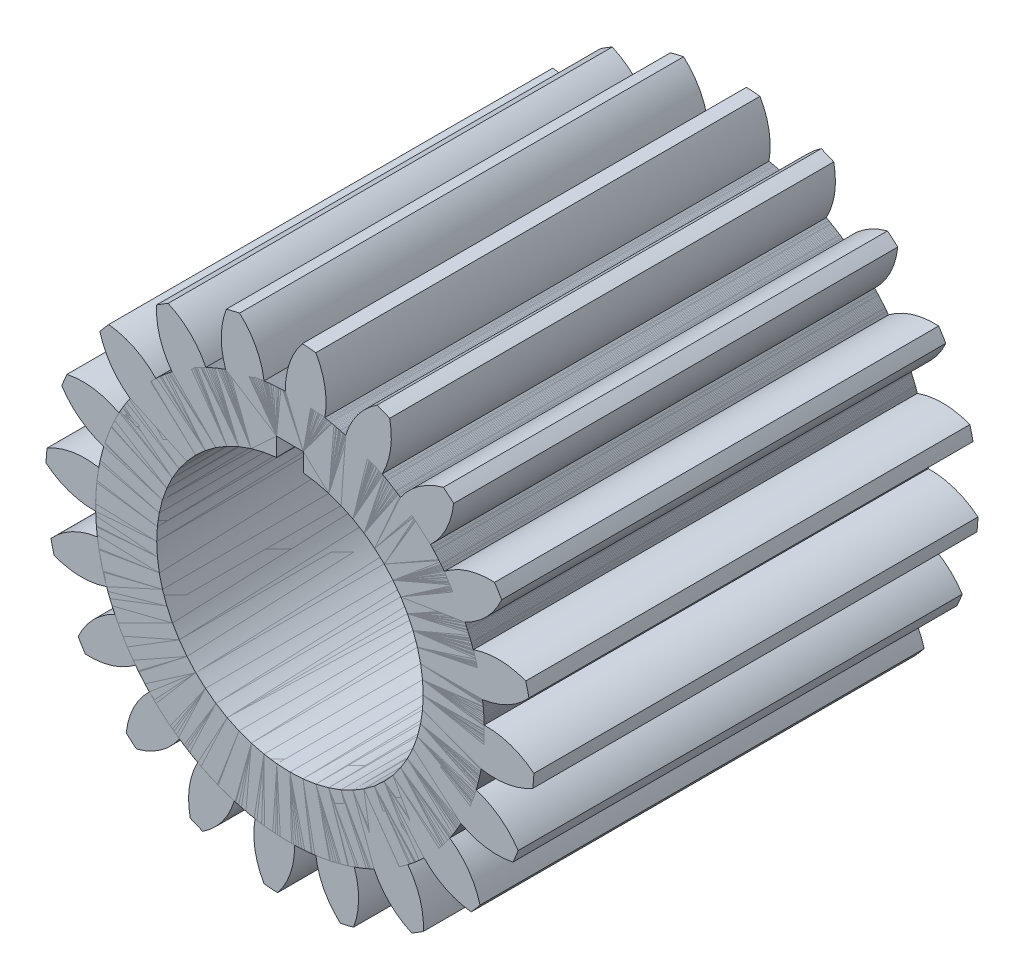
from build123d import *

# Parameters (mm, degrees)
SKETCH_1_R               = 21.875
EXTRUDE_1_DEPTH          = 50
EXTRUDE_START            = -50
EXTRUDE_2_DEPTH          = 50
PATTERN_CIRCULAR_1_COUNT = 20
SKETCH_3_R               = 15
CUT_EXTRUDE_1_DEPTH      = 64.313510489
SKETCH_6_W               = 3
SKETCH_6_H               = 17
CUT_EXTRUDE_4_DEPTH      = 64.313510489


with BuildPart() as part:
    # 草图1 → 凸台-拉伸1 (new body)
    with BuildSketch(Plane.XY):
        Circle(SKETCH_1_R)
    extrude(amount=EXTRUDE_1_DEPTH)

    # 草图2 → 凸台-拉伸2 (add)
    with BuildSketch(Plane.XY.offset(50).offset(EXTRUDE_START)):
        with BuildLine():
            ThreePointArc((2.917275003, 27.344825956), (2.157625133, 27.415226678), (1.396314713, 27.464528127))
            ThreePointArc((1.396314713, 27.464528127), (-0.057452176, 24.837047161), (-0.513162723, 21.868980064))
            ThreePointArc((-0.513162723, 21.868980064), (1.716292719, 21.807566675), (3.927907035, 21.519460293))
            ThreePointArc((3.927907035, 21.519460293), (3.94211503, 24.522274395), (2.917275003, 27.344825956))
        make_face()
    extrude(amount=EXTRUDE_2_DEPTH)


with BuildPart() as pattern_circular_1_1:
    # 阵列(圆周)1: pattern copy
    add(part.part.rotate(Axis((0, 0, 50), (0, 0, 1)), 1 * 360 / PATTERN_CIRCULAR_1_COUNT))


with BuildPart() as pattern_circular_1_2:
    # 阵列(圆周)1: pattern copy
    add(part.part.rotate(Axis((0, 0, 50), (0, 0, 1)), 2 * 360 / PATTERN_CIRCULAR_1_COUNT))


with BuildPart() as pattern_circular_1_3:
    # 阵列(圆周)1: pattern copy
    add(part.part.rotate(Axis((0, 0, 50), (0, 0, 1)), 3 * 360 / PATTERN_CIRCULAR_1_COUNT))


with BuildPart() as pattern_circular_1_4:
    # 阵列(圆周)1: pattern copy
    add(part.part.rotate(Axis((0, 0, 50), (0, 0, 1)), 4 * 360 / PATTERN_CIRCULAR_1_COUNT))


with BuildPart() as pattern_circular_1_5:
    # 阵列(圆周)1: pattern copy
    add(part.part.rotate(Axis((0, 0, 50), (0, 0, 1)), 5 * 360 / PATTERN_CIRCULAR_1_COUNT))


with BuildPart() as pattern_circular_1_6:
    # 阵列(圆周)1: pattern copy
    add(part.part.rotate(Axis((0, 0, 50), (0, 0, 1)), 6 * 360 / PATTERN_CIRCULAR_1_COUNT))


with BuildPart() as pattern_circular_1_7:
    # 阵列(圆周)1: pattern copy
    add(part.part.rotate(Axis((0, 0, 50), (0, 0, 1)), 7 * 360 / PATTERN_CIRCULAR_1_COUNT))


with BuildPart() as pattern_circular_1_8:
    # 阵列(圆周)1: pattern copy
    add(part.part.rotate(Axis((0, 0, 50), (0, 0, 1)), 8 * 360 / PATTERN_CIRCULAR_1_COUNT))


with BuildPart() as pattern_circular_1_9:
    # 阵列(圆周)1: pattern copy
    add(part.part.rotate(Axis((0, 0, 50), (0, 0, 1)), 9 * 360 / PATTERN_CIRCULAR_1_COUNT))


with BuildPart() as pattern_circular_1_10:
    # 阵列(圆周)1: pattern copy
    add(part.part.rotate(Axis((0, 0, 50), (0, 0, 1)), 10 * 360 / PATTERN_CIRCULAR_1_COUNT))


with BuildPart() as pattern_circular_1_11:
    # 阵列(圆周)1: pattern copy
    add(part.part.rotate(Axis((0, 0, 50), (0, 0, 1)), 11 * 360 / PATTERN_CIRCULAR_1_COUNT))


with BuildPart() as pattern_circular_1_12:
    # 阵列(圆周)1: pattern copy
    add(part.part.rotate(Axis((0, 0, 50), (0, 0, 1)), 12 * 360 / PATTERN_CIRCULAR_1_COUNT))


with BuildPart() as pattern_circular_1_13:
    # 阵列(圆周)1: pattern copy
    add(part.part.rotate(Axis((0, 0, 50), (0, 0, 1)), 13 * 360 / PATTERN_CIRCULAR_1_COUNT))


with BuildPart() as pattern_circular_1_14:
    # 阵列(圆周)1: pattern copy
    add(part.part.rotate(Axis((0, 0, 50), (0, 0, 1)), 14 * 360 / PATTERN_CIRCULAR_1_COUNT))


with BuildPart() as pattern_circular_1_15:
    # 阵列(圆周)1: pattern copy
    add(part.part.rotate(Axis((0, 0, 50), (0, 0, 1)), 15 * 360 / PATTERN_CIRCULAR_1_COUNT))


with BuildPart() as pattern_circular_1_16:
    # 阵列(圆周)1: pattern copy
    add(part.part.rotate(Axis((0, 0, 50), (0, 0, 1)), 16 * 360 / PATTERN_CIRCULAR_1_COUNT))


with BuildPart() as pattern_circular_1_17:
    # 阵列(圆周)1: pattern copy
    add(part.part.rotate(Axis((0, 0, 50), (0, 0, 1)), 17 * 360 / PATTERN_CIRCULAR_1_COUNT))


with BuildPart() as pattern_circular_1_18:
    # 阵列(圆周)1: pattern copy
    add(part.part.rotate(Axis((0, 0, 50), (0, 0, 1)), 18 * 360 / PATTERN_CIRCULAR_1_COUNT))


with BuildPart() as pattern_circular_1_19:
    # 阵列(圆周)1: pattern copy
    add(part.part.rotate(Axis((0, 0, 50), (0, 0, 1)), 19 * 360 / PATTERN_CIRCULAR_1_COUNT))


with BuildPart() as cut_extrude_1_tool:
    # 草图3 → 切除-拉伸1 (new, through all)
    with BuildSketch(Plane.XY.offset(50)):
        Circle(SKETCH_3_R)
    extrude(amount=-CUT_EXTRUDE_1_DEPTH)


with BuildPart() as part_1:
    add(part.part)

    # 切除-拉伸1: cut by cut_extrude_1_tool
    add(cut_extrude_1_tool.part, mode=Mode.SUBTRACT)


with BuildPart() as pattern_circular_1_1_1:
    add(pattern_circular_1_1.part)

    # 切除-拉伸1: cut by cut_extrude_1_tool
    add(cut_extrude_1_tool.part, mode=Mode.SUBTRACT)


with BuildPart() as pattern_circular_1_2_1:
    add(pattern_circular_1_2.part)

    # 切除-拉伸1: cut by cut_extrude_1_tool
    add(cut_extrude_1_tool.part, mode=Mode.SUBTRACT)


with BuildPart() as pattern_circular_1_3_1:
    add(pattern_circular_1_3.part)

    # 切除-拉伸1: cut by cut_extrude_1_tool
    add(cut_extrude_1_tool.part, mode=Mode.SUBTRACT)


with BuildPart() as pattern_circular_1_4_1:
    add(pattern_circular_1_4.part)

    # 切除-拉伸1: cut by cut_extrude_1_tool
    add(cut_extrude_1_tool.part, mode=Mode.SUBTRACT)


with BuildPart() as pattern_circular_1_5_1:
    add(pattern_circular_1_5.part)

    # 切除-拉伸1: cut by cut_extrude_1_tool
    add(cut_extrude_1_tool.part, mode=Mode.SUBTRACT)


with BuildPart() as pattern_circular_1_6_1:
    add(pattern_circular_1_6.part)

    # 切除-拉伸1: cut by cut_extrude_1_tool
    add(cut_extrude_1_tool.part, mode=Mode.SUBTRACT)


with BuildPart() as pattern_circular_1_7_1:
    add(pattern_circular_1_7.part)

    # 切除-拉伸1: cut by cut_extrude_1_tool
    add(cut_extrude_1_tool.part, mode=Mode.SUBTRACT)


with BuildPart() as pattern_circular_1_8_1:
    add(pattern_circular_1_8.part)

    # 切除-拉伸1: cut by cut_extrude_1_tool
    add(cut_extrude_1_tool.part, mode=Mode.SUBTRACT)


with BuildPart() as pattern_circular_1_9_1:
    add(pattern_circular_1_9.part)

    # 切除-拉伸1: cut by cut_extrude_1_tool
    add(cut_extrude_1_tool.part, mode=Mode.SUBTRACT)


with BuildPart() as pattern_circular_1_10_1:
    add(pattern_circular_1_10.part)

    # 切除-拉伸1: cut by cut_extrude_1_tool
    add(cut_extrude_1_tool.part, mode=Mode.SUBTRACT)


with BuildPart() as pattern_circular_1_11_1:
    add(pattern_circular_1_11.part)

    # 切除-拉伸1: cut by cut_extrude_1_tool
    add(cut_extrude_1_tool.part, mode=Mode.SUBTRACT)


with BuildPart() as pattern_circular_1_12_1:
    add(pattern_circular_1_12.part)

    # 切除-拉伸1: cut by cut_extrude_1_tool
    add(cut_extrude_1_tool.part, mode=Mode.SUBTRACT)


with BuildPart() as pattern_circular_1_13_1:
    add(pattern_circular_1_13.part)

    # 切除-拉伸1: cut by cut_extrude_1_tool
    add(cut_extrude_1_tool.part, mode=Mode.SUBTRACT)


with BuildPart() as pattern_circular_1_14_1:
    add(pattern_circular_1_14.part)

    # 切除-拉伸1: cut by cut_extrude_1_tool
    add(cut_extrude_1_tool.part, mode=Mode.SUBTRACT)


with BuildPart() as pattern_circular_1_15_1:
    add(pattern_circular_1_15.part)

    # 切除-拉伸1: cut by cut_extrude_1_tool
    add(cut_extrude_1_tool.part, mode=Mode.SUBTRACT)


with BuildPart() as pattern_circular_1_16_1:
    add(pattern_circular_1_16.part)

    # 切除-拉伸1: cut by cut_extrude_1_tool
    add(cut_extrude_1_tool.part, mode=Mode.SUBTRACT)


with BuildPart() as pattern_circular_1_17_1:
    add(pattern_circular_1_17.part)

    # 切除-拉伸1: cut by cut_extrude_1_tool
    add(cut_extrude_1_tool.part, mode=Mode.SUBTRACT)


with BuildPart() as pattern_circular_1_18_1:
    add(pattern_circular_1_18.part)

    # 切除-拉伸1: cut by cut_extrude_1_tool
    add(cut_extrude_1_tool.part, mode=Mode.SUBTRACT)


with BuildPart() as pattern_circular_1_19_1:
    add(pattern_circular_1_19.part)

    # 切除-拉伸1: cut by cut_extrude_1_tool
    add(cut_extrude_1_tool.part, mode=Mode.SUBTRACT)


with BuildPart() as cut_extrude_4_tool:
    # 草图6 → 切除-拉伸4 (new, through all)
    with BuildSketch(Plane.XY):
        with Locations((0, 8.5)):
            Rectangle(SKETCH_6_W, SKETCH_6_H)
    extrude(amount=CUT_EXTRUDE_4_DEPTH)


with BuildPart() as part_2:
    add(part_1.part)

    # 切除-拉伸4: cut by cut_extrude_4_tool
    add(cut_extrude_4_tool.part, mode=Mode.SUBTRACT)


with BuildPart() as pattern_circular_1_1_2:
    add(pattern_circular_1_1_1.part)

    # 切除-拉伸4: cut by cut_extrude_4_tool
    add(cut_extrude_4_tool.part, mode=Mode.SUBTRACT)


with BuildPart() as pattern_circular_1_2_2:
    add(pattern_circular_1_2_1.part)

    # 切除-拉伸4: cut by cut_extrude_4_tool
    add(cut_extrude_4_tool.part, mode=Mode.SUBTRACT)


with BuildPart() as pattern_circular_1_3_2:
    add(pattern_circular_1_3_1.part)

    # 切除-拉伸4: cut by cut_extrude_4_tool
    add(cut_extrude_4_tool.part, mode=Mode.SUBTRACT)


with BuildPart() as pattern_circular_1_4_2:
    add(pattern_circular_1_4_1.part)

    # 切除-拉伸4: cut by cut_extrude_4_tool
    add(cut_extrude_4_tool.part, mode=Mode.SUBTRACT)


with BuildPart() as pattern_circular_1_5_2:
    add(pattern_circular_1_5_1.part)

    # 切除-拉伸4: cut by cut_extrude_4_tool
    add(cut_extrude_4_tool.part, mode=Mode.SUBTRACT)


with BuildPart() as pattern_circular_1_6_2:
    add(pattern_circular_1_6_1.part)

    # 切除-拉伸4: cut by cut_extrude_4_tool
    add(cut_extrude_4_tool.part, mode=Mode.SUBTRACT)


with BuildPart() as pattern_circular_1_7_2:
    add(pattern_circular_1_7_1.part)

    # 切除-拉伸4: cut by cut_extrude_4_tool
    add(cut_extrude_4_tool.part, mode=Mode.SUBTRACT)


with BuildPart() as pattern_circular_1_8_2:
    add(pattern_circular_1_8_1.part)

    # 切除-拉伸4: cut by cut_extrude_4_tool
    add(cut_extrude_4_tool.part, mode=Mode.SUBTRACT)


with BuildPart() as pattern_circular_1_9_2:
    add(pattern_circular_1_9_1.part)

    # 切除-拉伸4: cut by cut_extrude_4_tool
    add(cut_extrude_4_tool.part, mode=Mode.SUBTRACT)


with BuildPart() as pattern_circular_1_10_2:
    add(pattern_circular_1_10_1.part)

    # 切除-拉伸4: cut by cut_extrude_4_tool
    add(cut_extrude_4_tool.part, mode=Mode.SUBTRACT)


with BuildPart() as pattern_circular_1_11_2:
    add(pattern_circular_1_11_1.part)

    # 切除-拉伸4: cut by cut_extrude_4_tool
    add(cut_extrude_4_tool.part, mode=Mode.SUBTRACT)


with BuildPart() as pattern_circular_1_12_2:
    add(pattern_circular_1_12_1.part)

    # 切除-拉伸4: cut by cut_extrude_4_tool
    add(cut_extrude_4_tool.part, mode=Mode.SUBTRACT)


with BuildPart() as pattern_circular_1_13_2:
    add(pattern_circular_1_13_1.part)

    # 切除-拉伸4: cut by cut_extrude_4_tool
    add(cut_extrude_4_tool.part, mode=Mode.SUBTRACT)


with BuildPart() as pattern_circular_1_14_2:
    add(pattern_circular_1_14_1.part)

    # 切除-拉伸4: cut by cut_extrude_4_tool
    add(cut_extrude_4_tool.part, mode=Mode.SUBTRACT)


with BuildPart() as pattern_circular_1_15_2:
    add(pattern_circular_1_15_1.part)

    # 切除-拉伸4: cut by cut_extrude_4_tool
    add(cut_extrude_4_tool.part, mode=Mode.SUBTRACT)


with BuildPart() as pattern_circular_1_16_2:
    add(pattern_circular_1_16_1.part)

    # 切除-拉伸4: cut by cut_extrude_4_tool
    add(cut_extrude_4_tool.part, mode=Mode.SUBTRACT)


with BuildPart() as pattern_circular_1_17_2:
    add(pattern_circular_1_17_1.part)

    # 切除-拉伸4: cut by cut_extrude_4_tool
    add(cut_extrude_4_tool.part, mode=Mode.SUBTRACT)


with BuildPart() as pattern_circular_1_18_2:
    add(pattern_circular_1_18_1.part)

    # 切除-拉伸4: cut by cut_extrude_4_tool
    add(cut_extrude_4_tool.part, mode=Mode.SUBTRACT)


with BuildPart() as pattern_circular_1_19_2:
    add(pattern_circular_1_19_1.part)

    # 切除-拉伸4: cut by cut_extrude_4_tool
    add(cut_extrude_4_tool.part, mode=Mode.SUBTRACT)


solid = Compound([part_2.part, pattern_circular_1_1_2.part, pattern_circular_1_2_2.part, pattern_circular_1_3_2.part, pattern_circular_1_4_2.part, pattern_circular_1_5_2.part, pattern_circular_1_6_2.part, pattern_circular_1_7_2.part, pattern_circular_1_8_2.part, pattern_circular_1_9_2.part, pattern_circular_1_10_2.part, pattern_circular_1_11_2.part, pattern_circular_1_12_2.part, pattern_circular_1_13_2.part, pattern_circular_1_14_2.part, pattern_circular_1_15_2.part, pattern_circular_1_16_2.part, pattern_circular_1_17_2.part, pattern_circular_1_18_2.part, pattern_circular_1_19_2.part])
